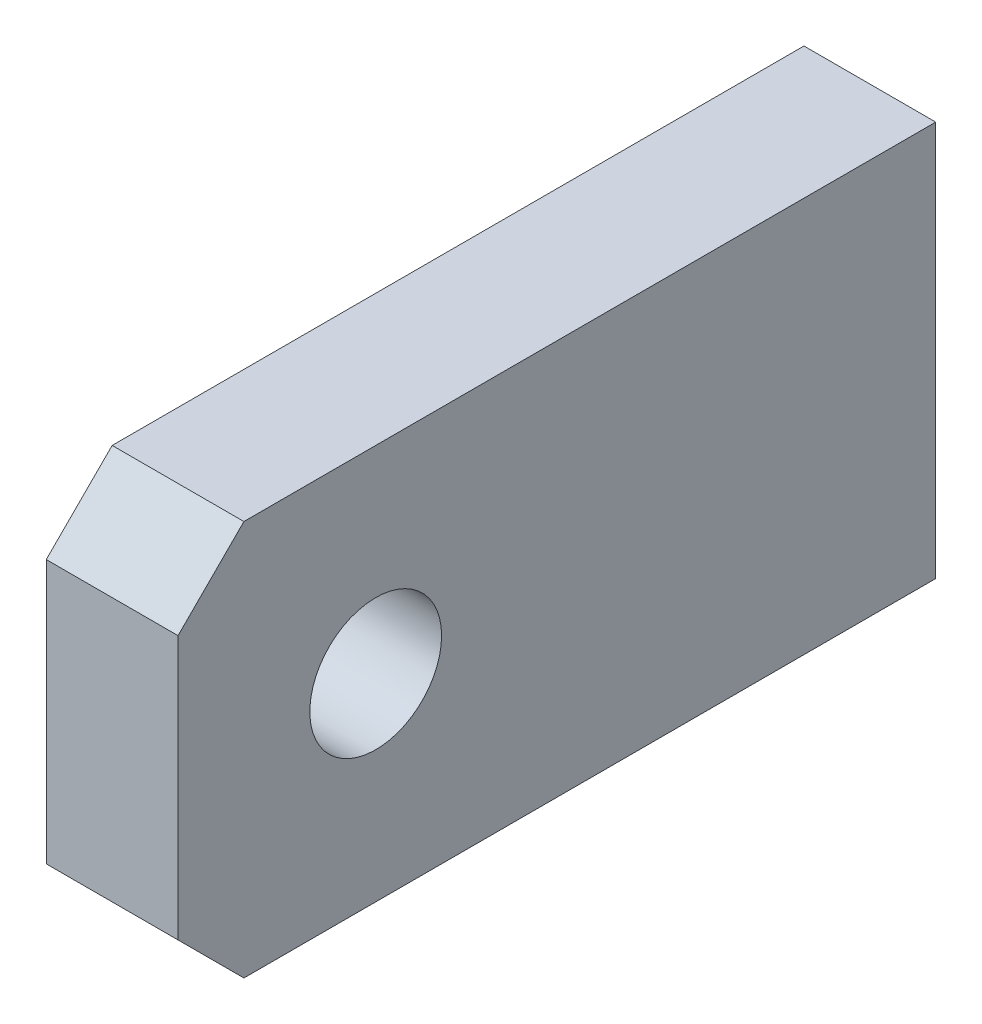
from build123d import *

# Parameters (mm, degrees)
SKETCH1_W           = 23
SKETCH1_H           = 12
BOSS_EXTRUDE1_DEPTH = 4
SKETCH2_R           = 1.5
CUT_EXTRUDE2_DEPTH  = 10
SKETCH3_R           = 2
CUT_EXTRUDE3_DEPTH  = 14.57387196
CHAMFER1_SIZE       = 2


with BuildPart() as part:
    # Sketch1 → Boss-Extrude1 (new body)
    with BuildSketch(Plane(origin=(0, 0, 0), x_dir=(0, 0, -1), z_dir=(1, 0, 0))):
        Rectangle(SKETCH1_W, SKETCH1_H)
    extrude(amount=BOSS_EXTRUDE1_DEPTH)

    # Sketch2 → Cut-Extrude2 (cut)
    with BuildSketch(Plane(origin=(0, 0, -11.5), x_dir=(-1, 0, 0), z_dir=(0, 0, -1))):
        with Locations((-1.96435802, -4)):
            Circle(SKETCH2_R)
        with Locations((-1.96435802, 4)):
            Circle(SKETCH2_R)
    extrude(amount=-CUT_EXTRUDE2_DEPTH, mode=Mode.SUBTRACT)

    # Sketch3 → Cut-Extrude3 (cut, through all)
    with BuildSketch(Plane(origin=(4, 0, 0), x_dir=(0, 0, -1), z_dir=(1, 0, 0))):
        with Locations((-5.5, 0)):
            Circle(SKETCH3_R)
    extrude(amount=-CUT_EXTRUDE3_DEPTH, mode=Mode.SUBTRACT)

    # Chamfer1
    chamfer1_edges = [part.edges().sort_by_distance(p)[0] for p in [
        (2, -6, 11.5),
        (2, 6, 11.5),
    ]]
    chamfer(chamfer1_edges, length=CHAMFER1_SIZE)


solid = part.part
